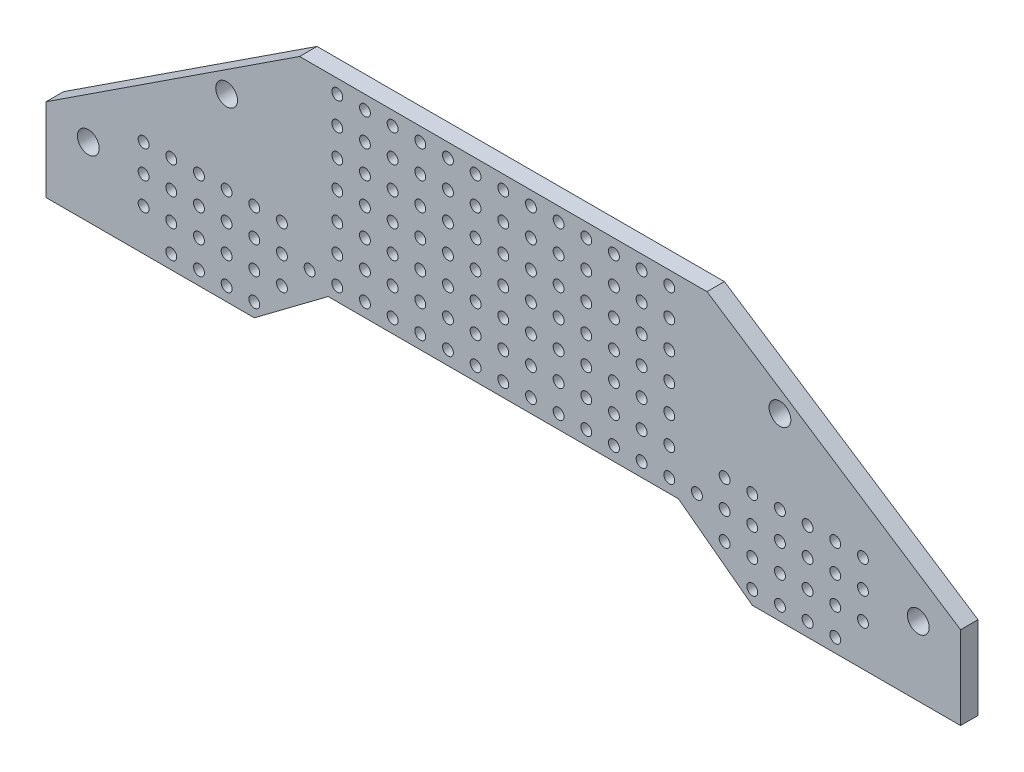
from build123d import *

# Parameters (mm, degrees)
SKETCH1_R           = 0.5
SKETCH1_R_2         = 1
BOSS_EXTRUDE1_DEPTH = 1.6


with BuildPart() as part:
    # Sketch1 → Boss-Extrude1 (new body)
    with BuildSketch(Plane.XY):
        Polygon((-16.081289857, 0), (16.081289857, 0), (22.86, -5.08), (41.982847472, -5.08), (41.982847472, 2.54), (18.7, 17.78), (-18.7, 17.78), (-41.982847472, 2.54), (-41.982847472, -5.08), (-22.86, -5.08), align=None)
        with Locations((0, 1.27)):
            Circle(SKETCH1_R, mode=Mode.SUBTRACT)
        with Locations((2.54, 1.27)):
            Circle(SKETCH1_R, mode=Mode.SUBTRACT)
        with Locations((5.08, 1.27)):
            Circle(SKETCH1_R, mode=Mode.SUBTRACT)
        with Locations((7.62, 1.27)):
            Circle(SKETCH1_R, mode=Mode.SUBTRACT)
        with Locations((10.16, 1.27)):
            Circle(SKETCH1_R, mode=Mode.SUBTRACT)
        with Locations((12.7, 1.27)):
            Circle(SKETCH1_R, mode=Mode.SUBTRACT)
        with Locations((15.24, 1.27)):
            Circle(SKETCH1_R, mode=Mode.SUBTRACT)
        with Locations((17.78, 1.27)):
            Circle(SKETCH1_R, mode=Mode.SUBTRACT)
        with Locations((20.32, 1.27)):
            Circle(SKETCH1_R, mode=Mode.SUBTRACT)
        with Locations((22.86, 1.27)):
            Circle(SKETCH1_R, mode=Mode.SUBTRACT)
        with Locations((25.4, 1.27)):
            Circle(SKETCH1_R, mode=Mode.SUBTRACT)
        with Locations((27.94, 1.27)):
            Circle(SKETCH1_R, mode=Mode.SUBTRACT)
        with Locations((30.48, 1.27)):
            Circle(SKETCH1_R, mode=Mode.SUBTRACT)
        with Locations((33.02, 1.27)):
            Circle(SKETCH1_R, mode=Mode.SUBTRACT)
        with Locations((20.32, 3.81)):
            Circle(SKETCH1_R, mode=Mode.SUBTRACT)
        with Locations((22.86, 3.81)):
            Circle(SKETCH1_R, mode=Mode.SUBTRACT)
        with Locations((25.4, 3.81)):
            Circle(SKETCH1_R, mode=Mode.SUBTRACT)
        with Locations((27.94, 3.81)):
            Circle(SKETCH1_R, mode=Mode.SUBTRACT)
        with Locations((30.48, 3.81)):
            Circle(SKETCH1_R, mode=Mode.SUBTRACT)
        with Locations((33.02, 3.81)):
            Circle(SKETCH1_R, mode=Mode.SUBTRACT)
        with Locations((20.32, -1.27)):
            Circle(SKETCH1_R, mode=Mode.SUBTRACT)
        with Locations((22.86, -1.27)):
            Circle(SKETCH1_R, mode=Mode.SUBTRACT)
        with Locations((25.4, -1.27)):
            Circle(SKETCH1_R, mode=Mode.SUBTRACT)
        with Locations((27.94, -1.27)):
            Circle(SKETCH1_R, mode=Mode.SUBTRACT)
        with Locations((30.48, -1.27)):
            Circle(SKETCH1_R, mode=Mode.SUBTRACT)
        with Locations((33.02, -1.27)):
            Circle(SKETCH1_R, mode=Mode.SUBTRACT)
        with Locations((0, 3.81)):
            Circle(SKETCH1_R, mode=Mode.SUBTRACT)
        with Locations((2.54, 3.81)):
            Circle(SKETCH1_R, mode=Mode.SUBTRACT)
        with Locations((5.08, 3.81)):
            Circle(SKETCH1_R, mode=Mode.SUBTRACT)
        with Locations((7.62, 3.81)):
            Circle(SKETCH1_R, mode=Mode.SUBTRACT)
        with Locations((10.16, 3.81)):
            Circle(SKETCH1_R, mode=Mode.SUBTRACT)
        with Locations((12.7, 3.81)):
            Circle(SKETCH1_R, mode=Mode.SUBTRACT)
        with Locations((15.24, 3.81)):
            Circle(SKETCH1_R, mode=Mode.SUBTRACT)
        with Locations((0, 6.35)):
            Circle(SKETCH1_R, mode=Mode.SUBTRACT)
        with Locations((2.54, 6.35)):
            Circle(SKETCH1_R, mode=Mode.SUBTRACT)
        with Locations((5.08, 6.35)):
            Circle(SKETCH1_R, mode=Mode.SUBTRACT)
        with Locations((7.62, 6.35)):
            Circle(SKETCH1_R, mode=Mode.SUBTRACT)
        with Locations((10.16, 6.35)):
            Circle(SKETCH1_R, mode=Mode.SUBTRACT)
        with Locations((12.7, 6.35)):
            Circle(SKETCH1_R, mode=Mode.SUBTRACT)
        with Locations((15.24, 6.35)):
            Circle(SKETCH1_R, mode=Mode.SUBTRACT)
        with Locations((0, 8.89)):
            Circle(SKETCH1_R, mode=Mode.SUBTRACT)
        with Locations((2.54, 8.89)):
            Circle(SKETCH1_R, mode=Mode.SUBTRACT)
        with Locations((5.08, 8.89)):
            Circle(SKETCH1_R, mode=Mode.SUBTRACT)
        with Locations((7.62, 8.89)):
            Circle(SKETCH1_R, mode=Mode.SUBTRACT)
        with Locations((10.16, 8.89)):
            Circle(SKETCH1_R, mode=Mode.SUBTRACT)
        with Locations((12.7, 8.89)):
            Circle(SKETCH1_R, mode=Mode.SUBTRACT)
        with Locations((15.24, 8.89)):
            Circle(SKETCH1_R, mode=Mode.SUBTRACT)
        with Locations((0, 11.43)):
            Circle(SKETCH1_R, mode=Mode.SUBTRACT)
        with Locations((2.54, 11.43)):
            Circle(SKETCH1_R, mode=Mode.SUBTRACT)
        with Locations((5.08, 11.43)):
            Circle(SKETCH1_R, mode=Mode.SUBTRACT)
        with Locations((7.62, 11.43)):
            Circle(SKETCH1_R, mode=Mode.SUBTRACT)
        with Locations((10.16, 11.43)):
            Circle(SKETCH1_R, mode=Mode.SUBTRACT)
        with Locations((12.7, 11.43)):
            Circle(SKETCH1_R, mode=Mode.SUBTRACT)
        with Locations((15.24, 11.43)):
            Circle(SKETCH1_R, mode=Mode.SUBTRACT)
        with Locations((0, 13.97)):
            Circle(SKETCH1_R, mode=Mode.SUBTRACT)
        with Locations((2.54, 13.97)):
            Circle(SKETCH1_R, mode=Mode.SUBTRACT)
        with Locations((5.08, 13.97)):
            Circle(SKETCH1_R, mode=Mode.SUBTRACT)
        with Locations((7.62, 13.97)):
            Circle(SKETCH1_R, mode=Mode.SUBTRACT)
        with Locations((10.16, 13.97)):
            Circle(SKETCH1_R, mode=Mode.SUBTRACT)
        with Locations((12.7, 13.97)):
            Circle(SKETCH1_R, mode=Mode.SUBTRACT)
        with Locations((15.24, 13.97)):
            Circle(SKETCH1_R, mode=Mode.SUBTRACT)
        with Locations((0, 16.51)):
            Circle(SKETCH1_R, mode=Mode.SUBTRACT)
        with Locations((2.54, 16.51)):
            Circle(SKETCH1_R, mode=Mode.SUBTRACT)
        with Locations((5.08, 16.51)):
            Circle(SKETCH1_R, mode=Mode.SUBTRACT)
        with Locations((7.62, 16.51)):
            Circle(SKETCH1_R, mode=Mode.SUBTRACT)
        with Locations((10.16, 16.51)):
            Circle(SKETCH1_R, mode=Mode.SUBTRACT)
        with Locations((12.7, 16.51)):
            Circle(SKETCH1_R, mode=Mode.SUBTRACT)
        with Locations((15.24, 16.51)):
            Circle(SKETCH1_R, mode=Mode.SUBTRACT)
        with Locations((22.86, -3.81)):
            Circle(SKETCH1_R, mode=Mode.SUBTRACT)
        with Locations((25.4, -3.81)):
            Circle(SKETCH1_R, mode=Mode.SUBTRACT)
        with Locations((27.94, -3.81)):
            Circle(SKETCH1_R, mode=Mode.SUBTRACT)
        with Locations((30.48, -3.81)):
            Circle(SKETCH1_R, mode=Mode.SUBTRACT)
        with Locations(Location((-30.48, -3.81, 0), (0, 0, 180))):
            Circle(SKETCH1_R, mode=Mode.SUBTRACT)
        with Locations(Location((-27.94, -3.81, 0), (0, 0, 180))):
            Circle(SKETCH1_R, mode=Mode.SUBTRACT)
        with Locations(Location((-25.4, -3.81, 0), (0, 0, 180))):
            Circle(SKETCH1_R, mode=Mode.SUBTRACT)
        with Locations(Location((-22.86, -3.81, 0), (0, 0, 180))):
            Circle(SKETCH1_R, mode=Mode.SUBTRACT)
        with Locations(Location((-15.24, 16.51, 0), (0, 0, 180))):
            Circle(SKETCH1_R, mode=Mode.SUBTRACT)
        with Locations(Location((-12.7, 16.51, 0), (0, 0, 180))):
            Circle(SKETCH1_R, mode=Mode.SUBTRACT)
        with Locations(Location((-10.16, 16.51, 0), (0, 0, 180))):
            Circle(SKETCH1_R, mode=Mode.SUBTRACT)
        with Locations(Location((-7.62, 16.51, 0), (0, 0, 180))):
            Circle(SKETCH1_R, mode=Mode.SUBTRACT)
        with Locations(Location((-5.08, 16.51, 0), (0, 0, 180))):
            Circle(SKETCH1_R, mode=Mode.SUBTRACT)
        with Locations(Location((-2.54, 16.51, 0), (0, 0, 180))):
            Circle(SKETCH1_R, mode=Mode.SUBTRACT)
        with Locations(Location((-15.24, 13.97, 0), (0, 0, 180))):
            Circle(SKETCH1_R, mode=Mode.SUBTRACT)
        with Locations(Location((-12.7, 13.97, 0), (0, 0, 180))):
            Circle(SKETCH1_R, mode=Mode.SUBTRACT)
        with Locations(Location((-10.16, 13.97, 0), (0, 0, 180))):
            Circle(SKETCH1_R, mode=Mode.SUBTRACT)
        with Locations(Location((-7.62, 13.97, 0), (0, 0, 180))):
            Circle(SKETCH1_R, mode=Mode.SUBTRACT)
        with Locations(Location((-5.08, 13.97, 0), (0, 0, 180))):
            Circle(SKETCH1_R, mode=Mode.SUBTRACT)
        with Locations(Location((-2.54, 13.97, 0), (0, 0, 180))):
            Circle(SKETCH1_R, mode=Mode.SUBTRACT)
        with Locations(Location((-15.24, 11.43, 0), (0, 0, 180))):
            Circle(SKETCH1_R, mode=Mode.SUBTRACT)
        with Locations(Location((-12.7, 11.43, 0), (0, 0, 180))):
            Circle(SKETCH1_R, mode=Mode.SUBTRACT)
        with Locations(Location((-10.16, 11.43, 0), (0, 0, 180))):
            Circle(SKETCH1_R, mode=Mode.SUBTRACT)
        with Locations(Location((-7.62, 11.43, 0), (0, 0, 180))):
            Circle(SKETCH1_R, mode=Mode.SUBTRACT)
        with Locations(Location((-5.08, 11.43, 0), (0, 0, 180))):
            Circle(SKETCH1_R, mode=Mode.SUBTRACT)
        with Locations(Location((-2.54, 11.43, 0), (0, 0, 180))):
            Circle(SKETCH1_R, mode=Mode.SUBTRACT)
        with Locations(Location((-15.24, 8.89, 0), (0, 0, 180))):
            Circle(SKETCH1_R, mode=Mode.SUBTRACT)
        with Locations(Location((-12.7, 8.89, 0), (0, 0, 180))):
            Circle(SKETCH1_R, mode=Mode.SUBTRACT)
        with Locations(Location((-10.16, 8.89, 0), (0, 0, 180))):
            Circle(SKETCH1_R, mode=Mode.SUBTRACT)
        with Locations(Location((-7.62, 8.89, 0), (0, 0, 180))):
            Circle(SKETCH1_R, mode=Mode.SUBTRACT)
        with Locations(Location((-5.08, 8.89, 0), (0, 0, 180))):
            Circle(SKETCH1_R, mode=Mode.SUBTRACT)
        with Locations(Location((-2.54, 8.89, 0), (0, 0, 180))):
            Circle(SKETCH1_R, mode=Mode.SUBTRACT)
        with Locations(Location((-15.24, 6.35, 0), (0, 0, 180))):
            Circle(SKETCH1_R, mode=Mode.SUBTRACT)
        with Locations(Location((-12.7, 6.35, 0), (0, 0, 180))):
            Circle(SKETCH1_R, mode=Mode.SUBTRACT)
        with Locations(Location((-10.16, 6.35, 0), (0, 0, 180))):
            Circle(SKETCH1_R, mode=Mode.SUBTRACT)
        with Locations(Location((-7.62, 6.35, 0), (0, 0, 180))):
            Circle(SKETCH1_R, mode=Mode.SUBTRACT)
        with Locations(Location((-5.08, 6.35, 0), (0, 0, 180))):
            Circle(SKETCH1_R, mode=Mode.SUBTRACT)
        with Locations(Location((-2.54, 6.35, 0), (0, 0, 180))):
            Circle(SKETCH1_R, mode=Mode.SUBTRACT)
        with Locations(Location((-15.24, 3.81, 0), (0, 0, 180))):
            Circle(SKETCH1_R, mode=Mode.SUBTRACT)
        with Locations(Location((-12.7, 3.81, 0), (0, 0, 180))):
            Circle(SKETCH1_R, mode=Mode.SUBTRACT)
        with Locations(Location((-10.16, 3.81, 0), (0, 0, 180))):
            Circle(SKETCH1_R, mode=Mode.SUBTRACT)
        with Locations(Location((-7.62, 3.81, 0), (0, 0, 180))):
            Circle(SKETCH1_R, mode=Mode.SUBTRACT)
        with Locations(Location((-5.08, 3.81, 0), (0, 0, 180))):
            Circle(SKETCH1_R, mode=Mode.SUBTRACT)
        with Locations(Location((-2.54, 3.81, 0), (0, 0, 180))):
            Circle(SKETCH1_R, mode=Mode.SUBTRACT)
        with Locations(Location((-33.02, -1.27, 0), (0, 0, 180))):
            Circle(SKETCH1_R, mode=Mode.SUBTRACT)
        with Locations(Location((-30.48, -1.27, 0), (0, 0, 180))):
            Circle(SKETCH1_R, mode=Mode.SUBTRACT)
        with Locations(Location((-27.94, -1.27, 0), (0, 0, 180))):
            Circle(SKETCH1_R, mode=Mode.SUBTRACT)
        with Locations(Location((-25.4, -1.27, 0), (0, 0, 180))):
            Circle(SKETCH1_R, mode=Mode.SUBTRACT)
        with Locations(Location((-22.86, -1.27, 0), (0, 0, 180))):
            Circle(SKETCH1_R, mode=Mode.SUBTRACT)
        with Locations(Location((-20.32, -1.27, 0), (0, 0, 180))):
            Circle(SKETCH1_R, mode=Mode.SUBTRACT)
        with Locations(Location((-33.02, 3.81, 0), (0, 0, 180))):
            Circle(SKETCH1_R, mode=Mode.SUBTRACT)
        with Locations(Location((-30.48, 3.81, 0), (0, 0, 180))):
            Circle(SKETCH1_R, mode=Mode.SUBTRACT)
        with Locations(Location((-27.94, 3.81, 0), (0, 0, 180))):
            Circle(SKETCH1_R, mode=Mode.SUBTRACT)
        with Locations(Location((-25.4, 3.81, 0), (0, 0, 180))):
            Circle(SKETCH1_R, mode=Mode.SUBTRACT)
        with Locations(Location((-22.86, 3.81, 0), (0, 0, 180))):
            Circle(SKETCH1_R, mode=Mode.SUBTRACT)
        with Locations(Location((-20.32, 3.81, 0), (0, 0, 180))):
            Circle(SKETCH1_R, mode=Mode.SUBTRACT)
        with Locations(Location((-33.02, 1.27, 0), (0, 0, 180))):
            Circle(SKETCH1_R, mode=Mode.SUBTRACT)
        with Locations(Location((-30.48, 1.27, 0), (0, 0, 180))):
            Circle(SKETCH1_R, mode=Mode.SUBTRACT)
        with Locations(Location((-27.94, 1.27, 0), (0, 0, 180))):
            Circle(SKETCH1_R, mode=Mode.SUBTRACT)
        with Locations(Location((-25.4, 1.27, 0), (0, 0, 180))):
            Circle(SKETCH1_R, mode=Mode.SUBTRACT)
        with Locations(Location((-22.86, 1.27, 0), (0, 0, 180))):
            Circle(SKETCH1_R, mode=Mode.SUBTRACT)
        with Locations(Location((-20.32, 1.27, 0), (0, 0, 180))):
            Circle(SKETCH1_R, mode=Mode.SUBTRACT)
        with Locations(Location((-17.78, 1.27, 0), (0, 0, 180))):
            Circle(SKETCH1_R, mode=Mode.SUBTRACT)
        with Locations(Location((-15.24, 1.27, 0), (0, 0, 180))):
            Circle(SKETCH1_R, mode=Mode.SUBTRACT)
        with Locations(Location((-12.7, 1.27, 0), (0, 0, 180))):
            Circle(SKETCH1_R, mode=Mode.SUBTRACT)
        with Locations(Location((-10.16, 1.27, 0), (0, 0, 180))):
            Circle(SKETCH1_R, mode=Mode.SUBTRACT)
        with Locations(Location((-7.62, 1.27, 0), (0, 0, 180))):
            Circle(SKETCH1_R, mode=Mode.SUBTRACT)
        with Locations(Location((-5.08, 1.27, 0), (0, 0, 180))):
            Circle(SKETCH1_R, mode=Mode.SUBTRACT)
        with Locations(Location((-2.54, 1.27, 0), (0, 0, 180))):
            Circle(SKETCH1_R, mode=Mode.SUBTRACT)
        with Locations((-38.1, 1.27)):
            Circle(SKETCH1_R_2, mode=Mode.SUBTRACT)
        with Locations(Location((38.1, 1.27, 0), (0, 0, 180))):
            Circle(SKETCH1_R_2, mode=Mode.SUBTRACT)
        with Locations((25.4, 11.43)):
            Circle(SKETCH1_R_2, mode=Mode.SUBTRACT)
        with Locations(Location((-25.4, 11.43, 0), (0, 0, 180))):
            Circle(SKETCH1_R_2, mode=Mode.SUBTRACT)
    extrude(amount=BOSS_EXTRUDE1_DEPTH)


solid = part.part
